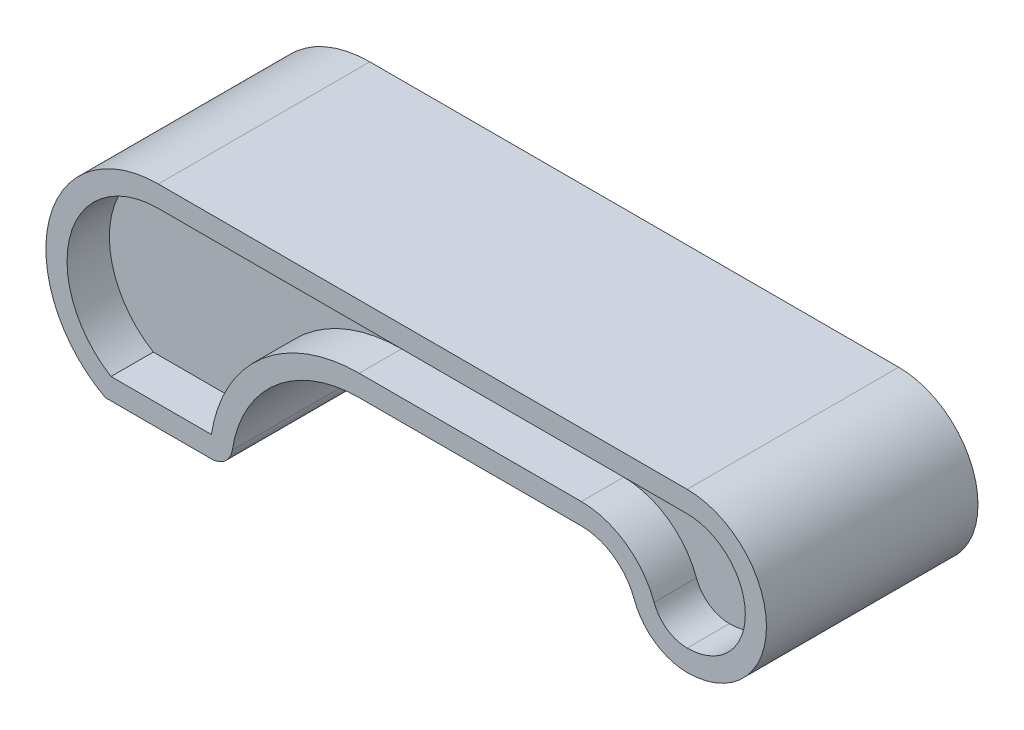
from build123d import *

# Parameters (mm, degrees)
BOSS_EXTRUDE1_DEPTH = 20
CUT_EXTRUDE1_DEPTH  = 4
SKETCH4_R           = 4
CUT_EXTRUDE2_DEPTH  = 2


with BuildPart() as part:
    # Sketch1 → Boss-Extrude1 (new body)
    with BuildSketch(Plane.XY):
        with BuildLine():
            Line((0, 0), (10, 0))
            ThreePointArc((10, 0), (11.31707778, 0.487218781), (12, 1.714285714))
            ThreePointArc((12, 1.714285714), (16.097533322, 9.076687314), (24, 12))
            Line((24, 12), (45, 12))
            ThreePointArc((45, 12), (48.051638904, 11.038055577), (50, 8.5))
            ThreePointArc((50, 8.5), (51.948361096, 5.961944423), (55, 5))
            ThreePointArc((55, 5), (62.5, 12.5), (55, 20))
            Line((55, 20), (5, 20))
            ThreePointArc((5, 20), (-5.307764064, 11.951941016), (0, 0))
        make_face()
    extrude(amount=BOSS_EXTRUDE1_DEPTH)

    # Sketch3 → Cut-Extrude1 (cut)
    with BuildSketch(Plane.XY.offset(20)):
        with BuildLine():
            Line((24, 14), (45, 14))
            ThreePointArc((45, 14), (49.198563593, 12.676519418), (51.879194631, 9.184563758))
            ThreePointArc((51.879194631, 9.184563758), (53.095285785, 7.600408264), (55, 7))
            ThreePointArc((55, 7), (60.5, 12.5), (55, 18))
            Line((55, 18), (5, 18))
            ThreePointArc((5, 18), (-3.306623863, 11.696771953), (0.527864045, 2))
            Line((0.527864045, 2), (10, 2))
            ThreePointArc((10, 2), (10.015495033, 2.005731986), (10.023529412, 2.020168067))
            ThreePointArc((10.023529412, 2.020168067), (14.795950575, 10.595200519), (24, 14))
        make_face()
    cut_extrude1 = extrude(amount=-CUT_EXTRUDE1_DEPTH, mode=Mode.SUBTRACT)

    # Mirror1: Cut-Extrude1 across plane
    add(cut_extrude1.mirror(Plane.XY.offset(10)), mode=Mode.SUBTRACT)

    # Sketch4 → Cut-Extrude2 (cut)
    with BuildSketch(Plane(origin=(0, 0, 0), x_dir=(-1, 0, 0), z_dir=(0, -1, 0))):
        with Locations(Location((-5, -10, 0), (0, 0, 90))):
            Circle(SKETCH4_R)
    extrude(amount=-CUT_EXTRUDE2_DEPTH, mode=Mode.SUBTRACT)


solid = part.part
